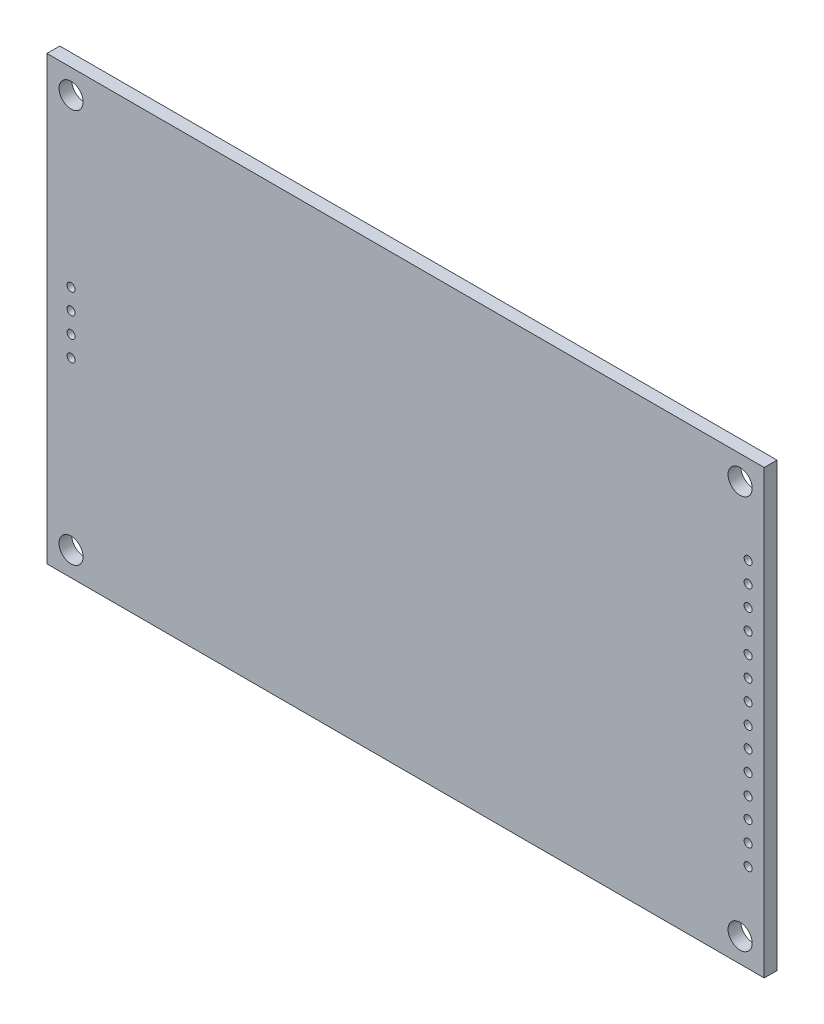
from build123d import *

# Parameters (mm, degrees)
SKIZZE1_W                       = 89.3
SKIZZE1_H                       = 55.04
AUFSATZ_LINEAR_AUSTRAGEN1_DEPTH = 1.6
SKIZZE2_R                       = 1.5
SKIZZE2_R_2                     = 0.5
SCHNITT_LINEAR_AUSTRAGEN1_DEPTH = 1.6


with BuildPart() as part:
    # Skizze1 → Aufsatz-Linear austragen1 (new body)
    with BuildSketch(Plane.XY):
        with Locations((0.35, 0.52)):
            Rectangle(SKIZZE1_W, SKIZZE1_H)
    extrude(amount=AUFSATZ_LINEAR_AUSTRAGEN1_DEPTH)

    # Skizze2 → Schnitt-Linear austragen1 (cut)
    with BuildSketch(Plane.XY.offset(1.6)):
        with Locations((-41.3, 25.04)):
            Circle(SKIZZE2_R)
        with Locations((-41.3, -24)):
            Circle(SKIZZE2_R)
        with Locations((42, 25.04)):
            Circle(SKIZZE2_R)
        with Locations((42, -24)):
            Circle(SKIZZE2_R)
        with Locations((43, 17.03)):
            Circle(SKIZZE2_R_2)
        with Locations((43, 14.49)):
            Circle(SKIZZE2_R_2)
        with Locations((43, 11.95)):
            Circle(SKIZZE2_R_2)
        with Locations((43, 9.41)):
            Circle(SKIZZE2_R_2)
        with Locations((43, 6.87)):
            Circle(SKIZZE2_R_2)
        with Locations((43, 4.33)):
            Circle(SKIZZE2_R_2)
        with Locations((43, 1.79)):
            Circle(SKIZZE2_R_2)
        with Locations((43, -0.75)):
            Circle(SKIZZE2_R_2)
        with Locations((43, -3.29)):
            Circle(SKIZZE2_R_2)
        with Locations((43, -5.83)):
            Circle(SKIZZE2_R_2)
        with Locations((43, -8.37)):
            Circle(SKIZZE2_R_2)
        with Locations((43, -10.91)):
            Circle(SKIZZE2_R_2)
        with Locations((43, -13.45)):
            Circle(SKIZZE2_R_2)
        with Locations((-41.3, 4.33)):
            Circle(SKIZZE2_R_2)
        with Locations((-41.3, 1.79)):
            Circle(SKIZZE2_R_2)
        with Locations((-41.3, -0.75)):
            Circle(SKIZZE2_R_2)
        with Locations((43, -15.99)):
            Circle(SKIZZE2_R_2)
        with Locations((-41.3, -3.29)):
            Circle(SKIZZE2_R_2)
    extrude(amount=-SCHNITT_LINEAR_AUSTRAGEN1_DEPTH, mode=Mode.SUBTRACT)


solid = part.part
